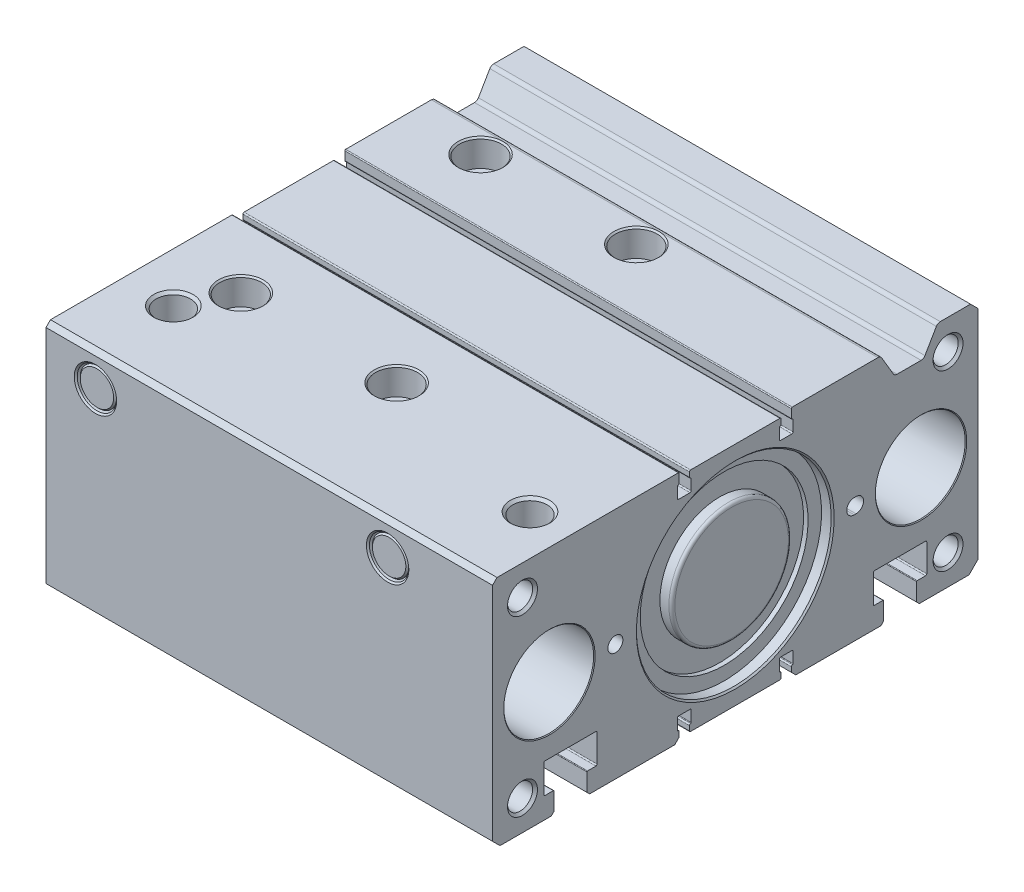
from build123d import *

# Parameters (mm, degrees)
EXTRUDE_1_DEPTH             = 149
PATTERN_LINEAR_1_COUNT      = 2
PATTERN_LINEAR_1_PITCH      = 52
PATTERN_LINEAR_1_COUNT_DIR2 = 2
PATTERN_LINEAR_1_PITCH_DIR2 = 80
HOLE_WIZARD_1_D             = 11.445
HOLE_WIZARD_1_DEPTH         = 13.05
HOLE_WIZARD_1_CSINK_D       = 13.157
HOLE_WIZARD_1_CSINK_ANGLE   = 90
HOLE_WIZARD_2_D             = 11.445
HOLE_WIZARD_2_DEPTH         = 13.05
HOLE_WIZARD_2_CSINK_D       = 13.157
HOLE_WIZARD_2_CSINK_ANGLE   = 90
SKETCH_16_W                 = 2.5
SKETCH_16_H                 = 8
PATTERN_LINEAR_2_COUNT      = 2
PATTERN_LINEAR_2_PITCH      = 142
PATTERN_LINEAR_2_COUNT_DIR2 = 2
PATTERN_LINEAR_2_PITCH_DIR2 = 58
HOLE_WIZARD_4_D             = 5
HOLE_WIZARD_4_DEPTH         = 8
HOLE_WIZARD_5_D             = 5
HOLE_WIZARD_5_DEPTH         = 8
HOLE_WIZARD_5_TIP           = 1.443375673
CUT_EXTRUDE_1_DEPTH         = 4
CUT_EXTRUDE_2_DEPTH         = 4


with BuildPart() as part:
    # 草图1 → 凸台-拉伸1 (new body)
    with BuildSketch(Plane(origin=(0, 0, 0), x_dir=(0, 0, -1), z_dir=(1, 0, 0))):
        with BuildLine():
            Line((-81, 37.5), (-81, -36.5))
            Line((-81, -36.5), (-78.5, -39))
            Line((-78.5, -39), (-61.4, -39))
            Line((-61.4, -39), (-60.5, -38.1))
            Line((-60.5, -38.1), (-60.5, -32.2))
            ThreePointArc((-60.5, -32.2), (-60.558578644, -32.058578644), (-60.7, -32))
            Line((-60.7, -32), (-63.5, -32))
            ThreePointArc((-63.5, -32), (-63.782842712, -31.882842712), (-63.9, -31.6))
            Line((-63.9, -31.6), (-63.9, -22.4))
            ThreePointArc((-63.9, -22.4), (-63.782842712, -22.117157288), (-63.5, -22))
            Line((-63.5, -22), (-46.5, -22))
            ThreePointArc((-46.5, -22), (-46.217157288, -22.117157288), (-46.1, -22.4))
            Line((-46.1, -22.4), (-46.1, -31.6))
            ThreePointArc((-46.1, -31.6), (-46.217157288, -31.882842712), (-46.5, -32))
            Line((-46.5, -32), (-49.3, -32))
            ThreePointArc((-49.3, -32), (-49.441421356, -32.058578644), (-49.5, -32.2))
            Line((-49.5, -32.2), (-49.5, -38.1))
            Line((-49.5, -38.1), (-48.6, -39))
            Line((-48.6, -39), (-20.2, -39))
            Line((-20.2, -39), (-18.7, -37.5))
            Line((-18.7, -37.5), (-18.7, -35.9))
            ThreePointArc((-18.7, -35.9), (-18.817157288, -35.617157288), (-19.1, -35.5))
            ThreePointArc((-19.1, -35.5), (-19.241421356, -35.441421356), (-19.3, -35.3))
            Line((-19.3, -35.3), (-19.3, -31.7))
            ThreePointArc((-19.3, -31.7), (-19.182842712, -31.417157288), (-18.9, -31.3))
            Line((-18.9, -31.3), (-15.1, -31.3))
            ThreePointArc((-15.1, -31.3), (-14.817157288, -31.417157288), (-14.7, -31.7))
            Line((-14.7, -31.7), (-14.7, -35.3))
            ThreePointArc((-14.7, -35.3), (-14.758578644, -35.441421356), (-14.9, -35.5))
            ThreePointArc((-14.9, -35.5), (-15.182842712, -35.617157288), (-15.3, -35.9))
            Line((-15.3, -35.9), (-15.3, -37.4))
            ThreePointArc((-15.3, -37.4), (-15.182842712, -37.682842712), (-14.9, -37.8))
            Line((-14.9, -37.8), (14.9, -37.8))
            ThreePointArc((14.9, -37.8), (15.182842712, -37.682842712), (15.3, -37.4))
            Line((15.3, -37.4), (15.3, -35.9))
            ThreePointArc((15.3, -35.9), (15.182842712, -35.617157288), (14.9, -35.5))
            ThreePointArc((14.9, -35.5), (14.758578644, -35.441421356), (14.7, -35.3))
            Line((14.7, -35.3), (14.7, -31.7))
            ThreePointArc((14.7, -31.7), (14.817157288, -31.417157288), (15.1, -31.3))
            Line((15.1, -31.3), (18.9, -31.3))
            ThreePointArc((18.9, -31.3), (19.182842712, -31.417157288), (19.3, -31.7))
            Line((19.3, -31.7), (19.3, -35.3))
            ThreePointArc((19.3, -35.3), (19.241421356, -35.441421356), (19.1, -35.5))
            ThreePointArc((19.1, -35.5), (18.817157288, -35.617157288), (18.7, -35.9))
            Line((18.7, -35.9), (18.7, -37.5))
            Line((18.7, -37.5), (20.2, -39))
            Line((20.2, -39), (48.6, -39))
            Line((48.6, -39), (49.5, -38.1))
            Line((49.5, -38.1), (49.5, -32.2))
            ThreePointArc((49.5, -32.2), (49.441421356, -32.058578644), (49.3, -32))
            Line((49.3, -32), (46.5, -32))
            ThreePointArc((46.5, -32), (46.217157288, -31.882842712), (46.1, -31.6))
            Line((46.1, -31.6), (46.1, -22.4))
            ThreePointArc((46.1, -22.4), (46.217157288, -22.117157288), (46.5, -22))
            Line((46.5, -22), (63.5, -22))
            ThreePointArc((63.5, -22), (63.782842712, -22.117157288), (63.9, -22.4))
            Line((63.9, -22.4), (63.9, -31.6))
            ThreePointArc((63.9, -31.6), (63.782842712, -31.882842712), (63.5, -32))
            Line((63.5, -32), (60.7, -32))
            ThreePointArc((60.7, -32), (60.558578644, -32.058578644), (60.5, -32.2))
            Line((60.5, -32.2), (60.5, -38.1))
            Line((60.5, -38.1), (61.4, -39))
            Line((61.4, -39), (78, -39))
            Line((78, -39), (81, -36))
            Line((81, -36), (81, 36.5))
            Line((81, 36.5), (78.5, 39))
            Line((78.5, 39), (68.4, 39))
            ThreePointArc((68.4, 39), (67.653670101, 38.801150138), (67.105216998, 38.257322242))
            Line((67.105216998, 38.257322242), (63.294783002, 31.742677758))
            ThreePointArc((63.294783002, 31.742677758), (62.746329899, 31.198849862), (62, 31))
            Line((62, 31), (54, 31))
            ThreePointArc((54, 31), (53.253670101, 31.198849862), (52.705216998, 31.742677758))
            Line((52.705216998, 31.742677758), (48.894783002, 38.257322242))
            ThreePointArc((48.894783002, 38.257322242), (48.346329899, 38.801150138), (47.6, 39))
            Line((47.6, 39), (19, 39))
            ThreePointArc((19, 39), (18.787867966, 38.912132034), (18.7, 38.7))
            Line((18.7, 38.7), (18.7, 35.9))
            ThreePointArc((18.7, 35.9), (18.817157288, 35.617157288), (19.1, 35.5))
            ThreePointArc((19.1, 35.5), (19.241421356, 35.441421356), (19.3, 35.3))
            Line((19.3, 35.3), (19.3, 31.7))
            ThreePointArc((19.3, 31.7), (19.182842712, 31.417157288), (18.9, 31.3))
            Line((18.9, 31.3), (15.1, 31.3))
            ThreePointArc((15.1, 31.3), (14.817157288, 31.417157288), (14.7, 31.7))
            Line((14.7, 31.7), (14.7, 35.3))
            ThreePointArc((14.7, 35.3), (14.758578644, 35.441421356), (14.9, 35.5))
            ThreePointArc((14.9, 35.5), (15.182842712, 35.617157288), (15.3, 35.9))
            Line((15.3, 35.9), (15.3, 37.4))
            ThreePointArc((15.3, 37.4), (15.182842712, 37.682842712), (14.9, 37.8))
            Line((14.9, 37.8), (-14.9, 37.8))
            ThreePointArc((-14.9, 37.8), (-15.182842712, 37.682842712), (-15.3, 37.4))
            Line((-15.3, 37.4), (-15.3, 35.9))
            ThreePointArc((-15.3, 35.9), (-15.182842712, 35.617157288), (-14.9, 35.5))
            ThreePointArc((-14.9, 35.5), (-14.758578644, 35.441421356), (-14.7, 35.3))
            Line((-14.7, 35.3), (-14.7, 31.7))
            ThreePointArc((-14.7, 31.7), (-14.817157288, 31.417157288), (-15.1, 31.3))
            Line((-15.1, 31.3), (-18.9, 31.3))
            ThreePointArc((-18.9, 31.3), (-19.182842712, 31.417157288), (-19.3, 31.7))
            Line((-19.3, 31.7), (-19.3, 35.3))
            ThreePointArc((-19.3, 35.3), (-19.241421356, 35.441421356), (-19.1, 35.5))
            ThreePointArc((-19.1, 35.5), (-18.817157288, 35.617157288), (-18.7, 35.9))
            Line((-18.7, 35.9), (-18.7, 38.7))
            ThreePointArc((-18.7, 38.7), (-18.787867966, 38.912132034), (-19, 39))
            Line((-19, 39), (-79.5, 39))
            Line((-79.5, 39), (-81, 37.5))
        make_face()
    extrude(amount=EXTRUDE_1_DEPTH)

    # 草图2 → 切除-旋转1 (revolve, cut)
    with BuildSketch(Plane.XY.offset(40)):
        Polygon((24, 39), (31.5, 39), (31, 38.5), (31, 30), (28.25, 30), (28.25, -20), (29, -20), (28.188, -20.812), (28.188, -39.188), (29, -40), (24, -40), align=None)
    cut_revolve_1 = revolve(axis=Axis((24, -40, 40), (0, 1, 0)), mode=Mode.SUBTRACT)

    # 阵列(线性)1: Cut-Revolve 1 2 × 2
    with Locations(*[(i * PATTERN_LINEAR_1_PITCH, 0, -j * PATTERN_LINEAR_1_PITCH_DIR2) for i in range(PATTERN_LINEAR_1_COUNT) for j in range(PATTERN_LINEAR_1_COUNT_DIR2) if (i, j) != (0, 0)]):
        add(cut_revolve_1, mode=Mode.SUBTRACT)

    # 草图4 → 切除-旋转2 (revolve, cut)
    with BuildSketch(Plane.XY.offset(62)):
        Polygon((0, 0), (0, 16.25), (0.25, 16), (1.5, 16), (1.5, 10), (99, 10), (99, 15), (148.75, 15), (149, 15.25), (149, 0), align=None)
    revolve(axis=Axis((149, 0, 62), (-1, 0, 0)), mode=Mode.SUBTRACT)

    # 草图5 → 切除-旋转3 (revolve, cut)
    with BuildSketch(Plane.XY.offset(-62)):
        Polygon((0, 0), (0, 16.25), (0.25, 16), (1.5, 16), (1.5, 10), (99, 10), (99, 15), (148.75, 15), (149, 15.25), (149, 0), align=None)
    revolve(axis=Axis((149, 0, -62), (-1, 0, 0)), mode=Mode.SUBTRACT)

    # 草图6 → 切除-旋转4 (revolve, cut)
    with BuildSketch(Plane.XY):
        Polygon((0, 0), (0, 32.75), (0.25, 32.5), (3.7, 32.5), (3.7, 28), (5.2, 28), (5.2, 10), (17.5, 10), (17.5, 31.5), (141, 31.5), (141, 0), align=None)
    revolve(axis=Axis((141, 0, 0), (-1, 0, 0)), mode=Mode.SUBTRACT)

    # 草图7 → 切除-旋转5 (revolve, cut)
    with BuildSketch(Plane.XY):
        Polygon((143.8, 0), (143.8, 28), (145.3, 28), (145.3, 32.5), (148.5, 32.5), (149, 33), (149, 0), align=None)
    revolve(axis=Axis((149, 0, 0), (-1, 0, 0)), mode=Mode.SUBTRACT)

    # 草图8 → 旋转1 (revolve)
    with BuildSketch(Plane.XY):
        with BuildLine():
            Line((143.8, 0), (143.8, 19.95))
            Line((143.8, 19.95), (146.8, 19.95))
            ThreePointArc((146.8, 19.95), (147.507106781, 19.657106781), (147.8, 18.95))
            Line((147.8, 18.95), (147.8, 0))
            Line((147.8, 0), (143.8, 0))
        make_face()
    revolve(axis=Axis((147.8, 0, 0), (-1, 0, 0)))

    # 草图9 → 旋转2 (revolve)
    with BuildSketch(Plane.XY):
        with BuildLine():
            Line((1.2, 10), (6.2, 10))
            Line((6.2, 10), (6.2, 19.95))
            Line((6.2, 19.95), (1.95, 19.95))
            ThreePointArc((1.95, 19.95), (1.419669914, 19.730330086), (1.2, 19.2))
            Line((1.2, 19.2), (1.2, 10))
        make_face()
    revolve(axis=Axis((6.2, 0, 0), (-1, 0, 0)))

    # 孔1
    with Locations(Plane(origin=(0, 39, 0), x_dir=(1, 0, 0), z_dir=(0, 1, 0))):
        with Locations((16.5, -55)):
            CounterSinkHole(HOLE_WIZARD_1_D / 2, HOLE_WIZARD_1_CSINK_D / 2, depth=HOLE_WIZARD_1_DEPTH, counter_sink_angle=HOLE_WIZARD_1_CSINK_ANGLE)

    # 孔2
    with Locations(Plane(origin=(0, 39, 0), x_dir=(1, 0, 0), z_dir=(0, 1, 0))):
        with Locations((135.5, -55)):
            CounterSinkHole(HOLE_WIZARD_2_D / 2, HOLE_WIZARD_2_CSINK_D / 2, depth=HOLE_WIZARD_2_DEPTH, counter_sink_angle=HOLE_WIZARD_2_CSINK_ANGLE)

    # 草图14 → 切除-旋转6 (revolve, cut)
    with BuildSketch(Plane(origin=(16.5, 0, 0), x_dir=(0, 0, -1), z_dir=(1, 0, 0))):
        Polygon((-81, 28), (-81, 35.0785), (-80.5, 34.5785), (-76.5, 34.5785), (-76.5, 34.0785), (-80, 34.0785), (-80.5, 33.5785), (-80.5, 28), align=None)
    revolve(axis=Axis((16.5, 28, 76.5), (0, 0, 1)), mode=Mode.SUBTRACT)

    # 草图15 → 切除-旋转7 (revolve, cut)
    with BuildSketch(Plane(origin=(114, 0, 0), x_dir=(0, 0, -1), z_dir=(1, 0, 0))):
        Polygon((-81, 28), (-81, 35.0785), (-80.5, 34.5785), (-76.5, 34.5785), (-76.5, 34.0785), (-80, 34.0785), (-80.5, 33.5785), (-80.5, 28), align=None)
    revolve(axis=Axis((114, 28, 76.5), (0, 0, 1)), mode=Mode.SUBTRACT)

    # 草图16 → 切除-旋转8 (revolve, cut)
    with BuildSketch(Plane.XY.offset(40)):
        with Locations((51.25, -36)):
            Rectangle(SKETCH_16_W, SKETCH_16_H)
    revolve(axis=Axis((50, -40, 40), (0, 1, 0)), mode=Mode.SUBTRACT)

    # 草图17 → 切除-旋转9 (revolve, cut)
    with BuildSketch(Plane.XY.offset(-40)):
        Polygon((50, -30.556624327), (52.5, -32), (52.5, -40), (50, -40), align=None)
    revolve(axis=Axis((50, -40, -40), (0, 1, 0)), mode=Mode.SUBTRACT)

    # 草图18 → 孔3 (revolve, cut)
    with BuildSketch(Plane(origin=(149, -29, 71), x_dir=(0, 0, -1), z_dir=(0, 1, 0))):
        Polygon((0, 0), (0, 28.817942927), (4.188, 26.4), (4.188, 0.812), (5, 0), align=None)
    hole_wizard_3 = revolve(axis=Axis((163.308894879, -29, 71), (-1, 0, 0)), mode=Mode.SUBTRACT)

    # 阵列(线性)2: Hole Wizard 3 2 × 2
    with Locations(*[(0, j * PATTERN_LINEAR_2_PITCH_DIR2, -i * PATTERN_LINEAR_2_PITCH) for i in range(PATTERN_LINEAR_2_COUNT) for j in range(PATTERN_LINEAR_2_COUNT_DIR2) if (i, j) != (0, 0)]):
        add(hole_wizard_3, mode=Mode.SUBTRACT)

    # 孔4
    with Locations(Plane(origin=(149, 0, 0), x_dir=(0, 0, -1), z_dir=(1, 0, 0))):
        with Locations((-40, 0)):
            Hole(HOLE_WIZARD_4_D / 2, depth=HOLE_WIZARD_4_DEPTH)

    # 孔5
    with Locations(Plane(origin=(149, 0, 0), x_dir=(0, 0, -1), z_dir=(1, 0, 0))):
        with Locations((40, 0)):
            Hole(HOLE_WIZARD_5_D / 2, depth=HOLE_WIZARD_5_DEPTH)
            with Locations((0, 0, -(HOLE_WIZARD_5_DEPTH + HOLE_WIZARD_5_TIP / 2))):  # 120° drill point
                Cone(0, HOLE_WIZARD_5_D / 2, HOLE_WIZARD_5_TIP, mode=Mode.SUBTRACT)

    # 草图25 → 切除-拉伸1 (cut)
    with BuildSketch(Plane(origin=(0, -39, 0), x_dir=(1, 0, 0), z_dir=(0, 1, 0))):
        with BuildLine():
            Line((52.5, 39.7), (52.5, 40.3))
            ThreePointArc((52.5, 40.3), (50, 42.8), (47.5, 40.3))
            Line((47.5, 40.3), (47.5, 39.7))
            ThreePointArc((47.5, 39.7), (50, 37.2), (52.5, 39.7))
        make_face()
    extrude(amount=CUT_EXTRUDE_1_DEPTH, mode=Mode.SUBTRACT)

    # 草图26 → 切除-拉伸2 (cut)
    with BuildSketch(Plane(origin=(149, 0, 0), x_dir=(0, 0, -1), z_dir=(1, 0, 0))):
        with BuildLine():
            Line((39.7, -2.5), (40.3, -2.5))
            ThreePointArc((40.3, -2.5), (42.8, 0), (40.3, 2.5))
            Line((40.3, 2.5), (39.7, 2.5))
            ThreePointArc((39.7, 2.5), (37.2, 0), (39.7, -2.5))
        make_face()
    extrude(amount=-CUT_EXTRUDE_2_DEPTH, mode=Mode.SUBTRACT)


solid = part.part
